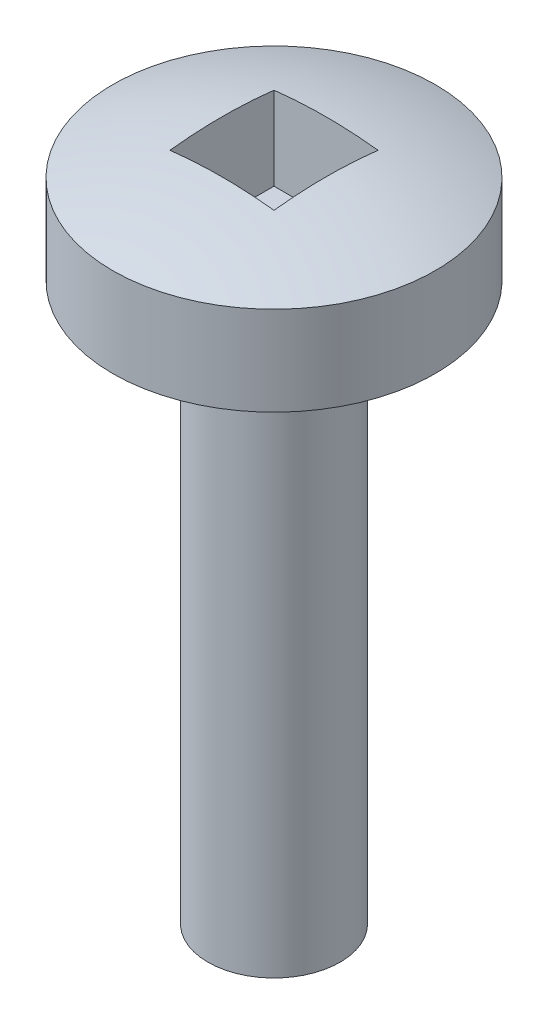
from build123d import *

# Parameters (mm, degrees)
SKETCH1_R            = 1.1303
THREADS_DEPTH        = 9.525
SKETCH2_R            = 2.7559
HEAD_DEPTH           = 1.524
HEADDOME_FACE_RADIUS = 2.7559
HEADDOME_HEIGHT      = 0.508
SKETCH3_W            = 1.778
SKETCH3_H            = 1.778
DRIVER_DEPTH         = 1.524


with BuildPart() as part:
    # Sketch1 → threads (new body)
    with BuildSketch(Plane(origin=(0, 0, 0), x_dir=(1, 0, 0), z_dir=(0, 1, 0))):
        with Locations(Location((0, 0, 0), (0, 0, 270))):
            Circle(SKETCH1_R)
    extrude(amount=-THREADS_DEPTH)

    # Sketch2 → Head (add)
    with BuildSketch(Plane(origin=(0, 0, 0), x_dir=(1, 0, 0), z_dir=(0, 1, 0))):
        with Locations(Location((0, 0, 0), (0, 0, 90))):
            Circle(SKETCH2_R)
    extrude(amount=HEAD_DEPTH)

    # HeadDome: a dome of height H over a round flat face of radius A is a cap of a sphere of radius (A * A + H * H) / (2 * H)
    headdome_r = (HEADDOME_FACE_RADIUS * HEADDOME_FACE_RADIUS + HEADDOME_HEIGHT * HEADDOME_HEIGHT) / (2 * HEADDOME_HEIGHT)
    headdome_base = Plane((0, 1.524, 0), z_dir=(0, 1, 0))
    with Locations(headdome_base.offset(HEADDOME_HEIGHT - headdome_r)):
        headdome_ball = Sphere(headdome_r, mode=Mode.PRIVATE)
    add(split(headdome_ball, bisect_by=headdome_base, keep=Keep.TOP, mode=Mode.PRIVATE))

    # Sketch3 → Driver (cut)
    with BuildSketch(Plane(origin=(0, 2.032, 0), x_dir=(1, 0, 0), z_dir=(0, 1, 0))):
        Rectangle(SKETCH3_W, SKETCH3_H)
    extrude(amount=-DRIVER_DEPTH, mode=Mode.SUBTRACT)


solid = part.part
